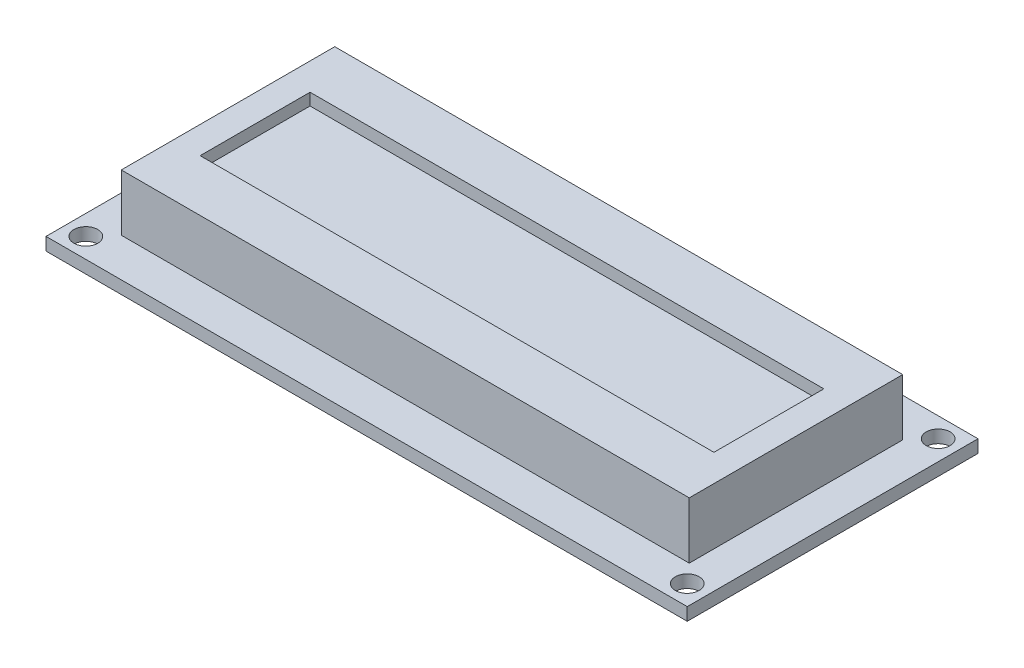
from build123d import *

# Parameters (mm, degrees)
SKETCH1_W           = 80.5
SKETCH1_H           = 36.5
BOSS_EXTRUDE1_DEPTH = 1.6
SKETCH2_R           = 1.5
CUT_EXTRUDE1_DEPTH  = 1.6
SKETCH3_W           = 71.3
SKETCH3_H           = 26.799999994
BOSS_EXTRUDE2_DEPTH = 7.1
SKETCH4_R           = 0.5
CUT_EXTRUDE2_DEPTH  = 7.1
SKETCH5_W           = 64.5
SKETCH5_H           = 13.8
CUT_EXTRUDE3_DEPTH  = 1.5


with BuildPart() as part:
    # Sketch1 → Boss-Extrude1 (new body)
    with BuildSketch(Plane(origin=(0, 0, 0), x_dir=(1, 0, 0), z_dir=(0, 1, 0))):
        Rectangle(SKETCH1_W, SKETCH1_H)
    extrude(amount=BOSS_EXTRUDE1_DEPTH)

    # Sketch2 → Cut-Extrude1 (cut)
    with BuildSketch(Plane(origin=(0, 1.6, 0), x_dir=(1, 0, 0), z_dir=(0, 1, 0))):
        with Locations(Location((-37.75, 15.75, 0), (0, 0, 270))):
            Circle(SKETCH2_R)
        with Locations(Location((-37.75, -15.75, 0), (0, 0, 270))):
            Circle(SKETCH2_R)
        with Locations(Location((37.75, 15.75, 0), (0, 0, 270))):
            Circle(SKETCH2_R)
        with Locations(Location((37.75, -15.75, 0), (0, 0, 270))):
            Circle(SKETCH2_R)
    extrude(amount=-CUT_EXTRUDE1_DEPTH, mode=Mode.SUBTRACT)

    # Sketch3 → Boss-Extrude2 (add)
    with BuildSketch(Plane(origin=(0, 1.6, 0), x_dir=(1, 0, 0), z_dir=(0, 1, 0))):
        Rectangle(SKETCH3_W, SKETCH3_H)
    extrude(amount=BOSS_EXTRUDE2_DEPTH)

    # Sketch4 → Cut-Extrude2 (cut)
    with BuildSketch(Plane(origin=(0, 1.6, 0), x_dir=(1, 0, 0), z_dir=(0, 1, 0))):
        with Locations(Location((-32.25, 15.75, 0), (0, 0, 270))):
            Circle(SKETCH4_R)
        with Locations(Location((-29.71, 15.75, 0), (0, 0, 270))):
            Circle(SKETCH4_R)
        with Locations(Location((-27.17, 15.75, 0), (0, 0, 270))):
            Circle(SKETCH4_R)
        with Locations(Location((-24.63, 15.75, 0), (0, 0, 270))):
            Circle(SKETCH4_R)
        with Locations(Location((-22.09, 15.75, 0), (0, 0, 270))):
            Circle(SKETCH4_R)
        with Locations(Location((-19.55, 15.75, 0), (0, 0, 270))):
            Circle(SKETCH4_R)
        with Locations(Location((-17.01, 15.75, 0), (0, 0, 270))):
            Circle(SKETCH4_R)
        with Locations(Location((-14.47, 15.75, 0), (0, 0, 270))):
            Circle(SKETCH4_R)
        with Locations(Location((-11.93, 15.75, 0), (0, 0, 270))):
            Circle(SKETCH4_R)
        with Locations(Location((-9.39, 15.75, 0), (0, 0, 270))):
            Circle(SKETCH4_R)
        with Locations(Location((-6.85, 15.75, 0), (0, 0, 270))):
            Circle(SKETCH4_R)
        with Locations(Location((-4.31, 15.75, 0), (0, 0, 270))):
            Circle(SKETCH4_R)
        with Locations(Location((-1.77, 15.75, 0), (0, 0, 270))):
            Circle(SKETCH4_R)
        with Locations(Location((0.77, 15.75, 0), (0, 0, 270))):
            Circle(SKETCH4_R)
        with Locations(Location((3.31, 15.75, 0), (0, 0, 270))):
            Circle(SKETCH4_R)
        with Locations(Location((5.85, 15.75, 0), (0, 0, 270))):
            Circle(SKETCH4_R)
    extrude(amount=-CUT_EXTRUDE2_DEPTH, mode=Mode.SUBTRACT)

    # Sketch5 → Cut-Extrude3 (cut)
    with BuildSketch(Plane(origin=(0, 8.7, 0), x_dir=(1, 0, 0), z_dir=(0, 1, 0))):
        Rectangle(SKETCH5_W, SKETCH5_H)
    extrude(amount=-CUT_EXTRUDE3_DEPTH, mode=Mode.SUBTRACT)


solid = part.part
